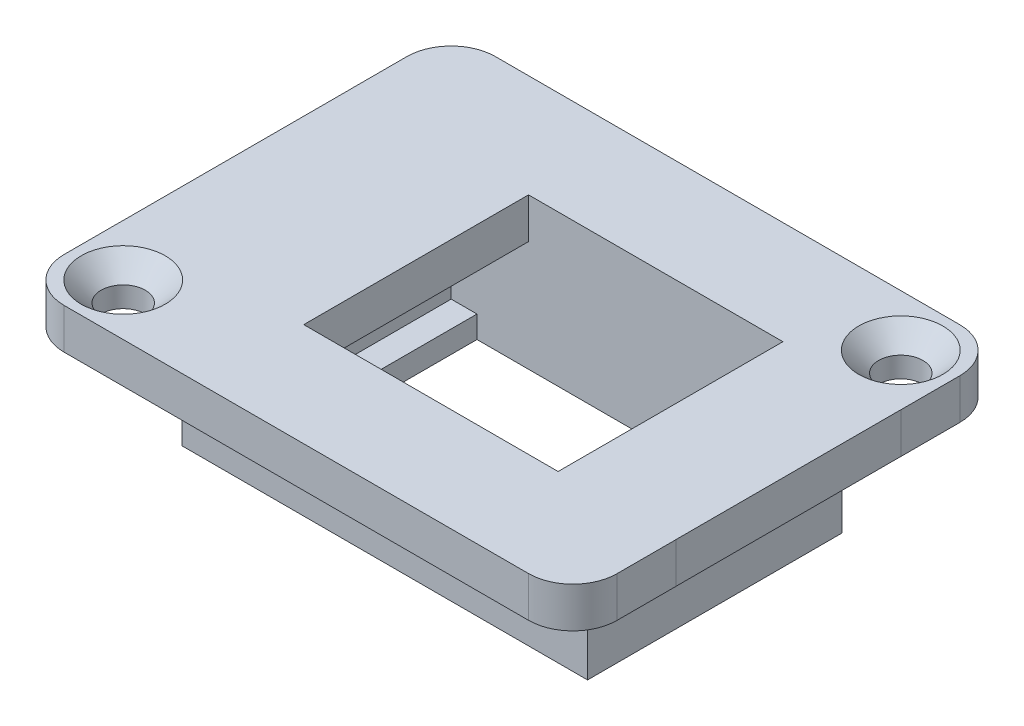
from build123d import *

# Parameters (mm, degrees)
BOSS_EXTRUDE1_DEPTH   = 15.25
BOSS_EXTRUDE1_2_DEPTH = 15.25
SKETCH2_W             = 37.506767834
SKETCH2_H             = 2.746604554
BOSS_EXTRUDE2_DEPTH   = 7
SKETCH3_W             = 37.506767834
SKETCH3_H             = 2.746604554
BOSS_EXTRUDE3_DEPTH   = 7
SKETCH9_R             = 1.5
CUT_EXTRUDE1_DEPTH    = 12
FILLET1_R             = 3
SKETCH11_W            = 27.5
SKETCH11_H            = 1
BOSS_EXTRUDE5_DEPTH   = 7.503395


with BuildPart() as part:
    # Sketch1 → Boss-Extrude1 (new body)
    with BuildSketch(Plane.XY):
        Polygon((10.25, -8), (10.25, -9.5), (13.75, -9.5), (13.75, -1.996604554), (18.75, -1.996604554), (18.75, 0.75), (10.753383917, 0.75), (10.753383917, -1.996604554), (11.75, -1.996604554), (11.75, -8), align=None)
    extrude(amount=BOSS_EXTRUDE1_DEPTH)



with BuildPart() as body_2:
    # Sketch1 → Boss-Extrude1 2 (new body)
    with BuildSketch(Plane.XY):
        Polygon((-11.75, -8), (-10, -8), (-10, -9.5), (-13.75, -9.5), (-13.75, -1.996604554), (-18.75, -1.996604554), (-18.75, 0.75), (-6.503383917, 0.75), (-6.503383917, -1.996604554), (-11.75, -1.996604554), align=None)
    extrude(amount=BOSS_EXTRUDE1_2_DEPTH)


with BuildPart() as part_1:
    add(part.part)

    add(body_2.part)  # Boss-Extrude2 merges body 2
    # Sketch2 → Boss-Extrude2 (add)
    with BuildSketch(Plane.XY.offset(15.25)):
        with Locations((0, -0.623302277)):
            Rectangle(SKETCH2_W, SKETCH2_H)
    extrude(amount=BOSS_EXTRUDE2_DEPTH)

    # Sketch3 → Boss-Extrude3 (add)
    with BuildSketch(Plane(origin=(0, 0, 0), x_dir=(-1, 0, 0), z_dir=(0, 0, -1))):
        with Locations((0, -0.623302277)):
            Rectangle(SKETCH3_W, SKETCH3_H)
    extrude(amount=BOSS_EXTRUDE3_DEPTH)

    # Sketch9 → Cut-Extrude1 (cut)
    with BuildSketch(Plane.XZ.offset(1.996604554)):
        with Locations(Location((-15.25, 18.75, 0), (0, 0, 270))):
            Circle(SKETCH9_R)
        with Locations(Location((15.25, -3.5, 0), (0, 0, 270))):
            Circle(SKETCH9_R)
    extrude(amount=-CUT_EXTRUDE1_DEPTH, mode=Mode.SUBTRACT)

    # Fillet1
    fillet1_edges = [part_1.edges().sort_by_distance(p)[0] for p in [
        (-18.753383917, -0.623302277, 22.25),
        (18.753383917, -0.623302277, 22.25),
        (18.753383917, -0.623302277, -7),
        (-18.753383917, -0.623302277, -7),
    ]]
    fillet(fillet1_edges, radius=FILLET1_R)

    # Cut-Extrude2 cone 1 section (through the dimple's axis) → Cut-Extrude2 (revolve, cut)
    with BuildSketch(Plane(origin=(-15.25, 0.75, 18.75), x_dir=(0, 0, 1), z_dir=(1, 0, 0))):
        Polygon((0, 0), (2.85, 0), (0, 2.85), align=None)
    revolve(axis=Axis((-15.25, 0.75, 18.75), (0, -1, 0)), mode=Mode.SUBTRACT)

    # Cut-Extrude2 cone 2 section (through the dimple's axis) → Cut-Extrude2 cone 2 (revolve, cut)
    with BuildSketch(Plane(origin=(15.25, 0.75, -3.5), x_dir=(0, 0, 1), z_dir=(1, 0, 0))):
        Polygon((0, 0), (2.85, 0), (0, 2.85), align=None)
    revolve(axis=Axis((15.25, 0.75, -3.5), (0, -1, 0)), mode=Mode.SUBTRACT)

    # Sketch11 → Boss-Extrude5 (add)
    with BuildSketch(Plane.XZ.offset(1.996604554)):
        with Locations((0, 15.75)):
            Rectangle(SKETCH11_W, SKETCH11_H)
        with Locations((0, -0.5)):
            Rectangle(SKETCH11_W, SKETCH11_H)
    extrude(amount=BOSS_EXTRUDE5_DEPTH)


solid = part_1.part
